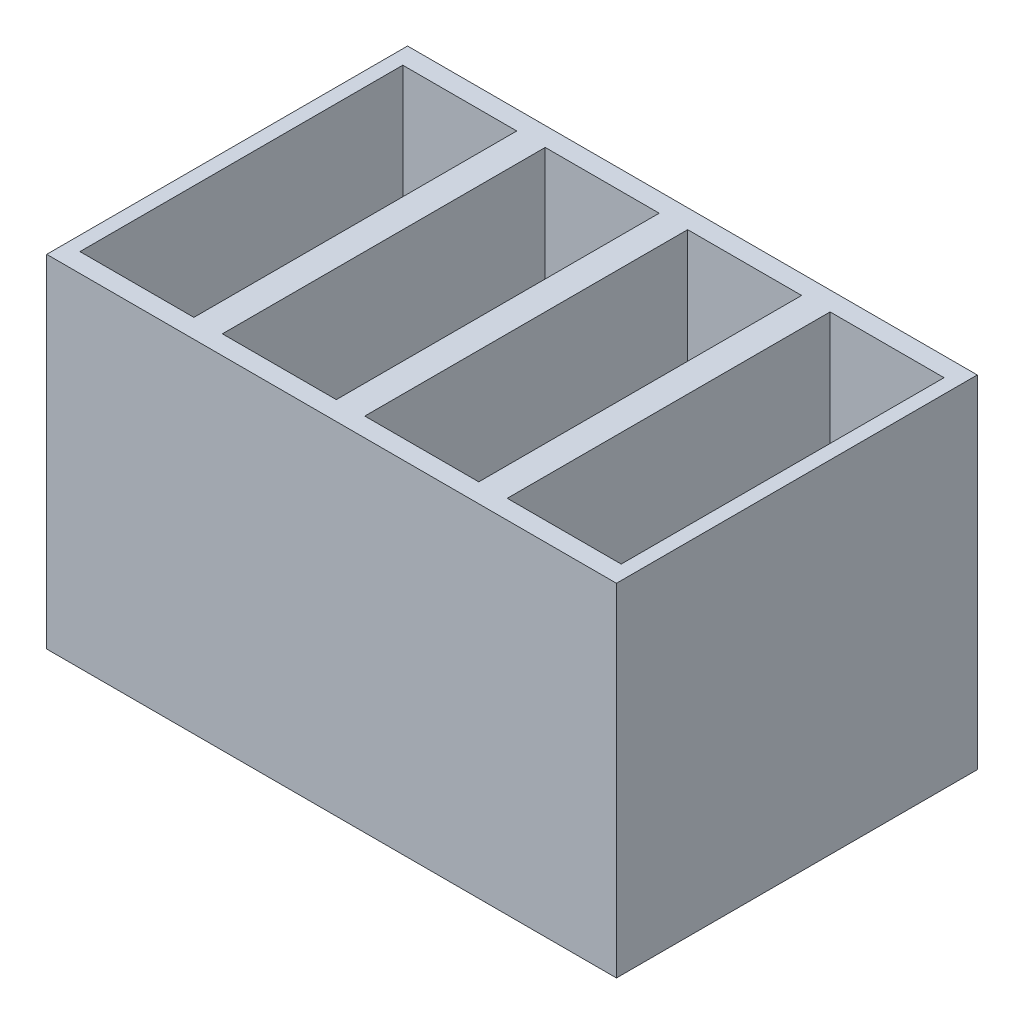
from build123d import *

# Parameters (mm, degrees)
SKETCH1_W           = 1524
SKETCH1_H           = 965.2
SKETCH1_W_2         = 304.8
SKETCH1_H_2         = 863.6
BOSS_EXTRUDE2_DEPTH = 914.4


with BuildPart() as part:
    # Sketch1 → Boss-Extrude2 (new body)
    with BuildSketch(Plane(origin=(0, 0, 0), x_dir=(1, 0, 0), z_dir=(0, 1, 0))):
        with Locations((-1066.8, 0)):
            Rectangle(SKETCH1_W, SKETCH1_H)
        with Locations((-1638.3, 0)):
            Rectangle(SKETCH1_W_2, SKETCH1_H_2, mode=Mode.SUBTRACT)
        with Locations((-1257.3, 0)):
            Rectangle(SKETCH1_W_2, SKETCH1_H_2, mode=Mode.SUBTRACT)
        with Locations((-876.3, 0)):
            Rectangle(SKETCH1_W_2, SKETCH1_H_2, mode=Mode.SUBTRACT)
        with Locations((-495.3, 0)):
            Rectangle(SKETCH1_W_2, SKETCH1_H_2, mode=Mode.SUBTRACT)
    extrude(amount=BOSS_EXTRUDE2_DEPTH)


solid = part.part
